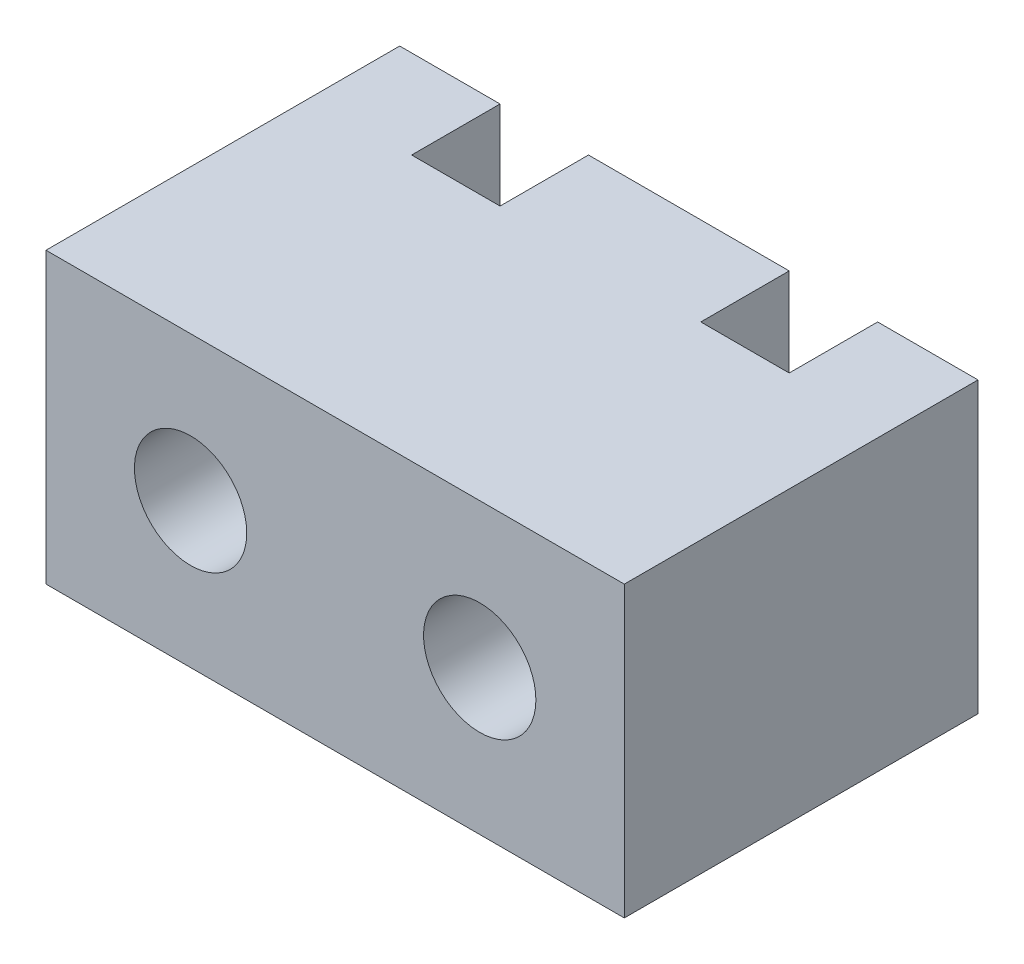
from build123d import *

# Parameters (mm, degrees)
SKETCH1_W           = 32.7
SKETCH1_H           = 16.35
SKETCH1_R           = 3.175
BOSS_EXTRUDE1_DEPTH = 10
SKETCH2_W           = 5
SKETCH2_H           = 16.35
CUT_EXTRUDE1_DEPTH  = 5


with BuildPart() as part:
    # Sketch1 → Boss-Extrude1 (new, symmetric)
    with BuildSketch(Plane.XY):
        Rectangle(SKETCH1_W, SKETCH1_H)
        with Locations((-8.175, 0)):
            Circle(SKETCH1_R, mode=Mode.SUBTRACT)
        with Locations((8.175, 0)):
            Circle(SKETCH1_R, mode=Mode.SUBTRACT)
    extrude(amount=BOSS_EXTRUDE1_DEPTH, both=True)

    # Sketch2 → Cut-Extrude1 (cut)
    with BuildSketch(Plane(origin=(0, 0, -10), x_dir=(-1, 0, 0), z_dir=(0, 0, -1))):
        with Locations((-8.175, 0)):
            Rectangle(SKETCH2_W, SKETCH2_H)
        with Locations((8.175, 0)):
            Rectangle(SKETCH2_W, SKETCH2_H)
    extrude(amount=-CUT_EXTRUDE1_DEPTH, mode=Mode.SUBTRACT)


solid = part.part
